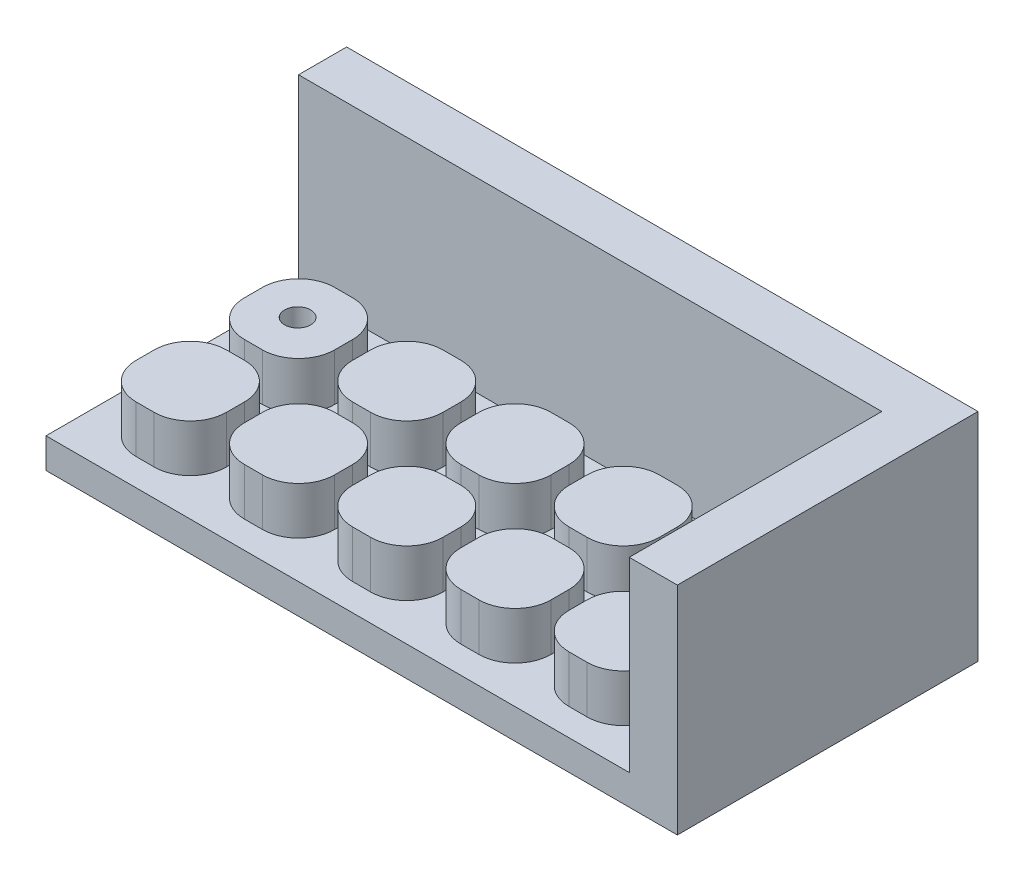
from build123d import *

# Parameters (mm, degrees)
SKETCH2_W            = 133.35
SKETCH2_H            = 63.5
BOSS_EXTRUDE2_DEPTH  = 6.35
BOSS_EXTRUDE3_DEPTH  = 45.72
BOSS_EXTRUDE1_DEPTH  = 10
LPATTERN1_COUNT      = 5
LPATTERN1_PITCH      = 22.86
LPATTERN1_COUNT_DIR2 = 2
LPATTERN1_PITCH_DIR2 = 22.86
SKETCH6_R            = 2.75
CUT_EXTRUDE1_DEPTH   = 5.5


with BuildPart() as part:
    # Sketch2 → Boss-Extrude2 (new body)
    with BuildSketch(Plane(origin=(0, 0, 0), x_dir=(1, 0, 0), z_dir=(0, 1, 0))):
        with Locations((66.675, 31.75)):
            Rectangle(SKETCH2_W, SKETCH2_H)
    extrude(amount=BOSS_EXTRUDE2_DEPTH)

    # Sketch2<4> → Boss-Extrude3 (add)
    with BuildSketch(Plane(origin=(0, 0, 0), x_dir=(1, 0, 0), z_dir=(0, 1, 0))):
        Polygon((123.19, 53.34), (123.19, 0), (133.35, 0), (133.35, 63.5), (0, 63.5), (0, 53.34), align=None)
    extrude(amount=BOSS_EXTRUDE3_DEPTH)

    # Sketch1 → Boss-Extrude1 (add)
    with BuildSketch(Plane(origin=(0, 6.35, 6.35), x_dir=(1, 0, 0), z_dir=(0, 1, 0))):
        with BuildLine():
            Line((13.335, 31.115), (17.145, 31.115))
            ThreePointArc((17.145, 31.115), (22.533153673, 28.883153673), (24.765, 23.495))
            Line((24.765, 23.495), (24.765, 19.685))
            ThreePointArc((24.765, 19.685), (22.533153673, 14.296846327), (17.145, 12.065))
            Line((17.145, 12.065), (13.335, 12.065))
            ThreePointArc((13.335, 12.065), (7.946846327, 14.296846327), (5.715, 19.685))
            Line((5.715, 19.685), (5.715, 23.495))
            ThreePointArc((5.715, 23.495), (7.946846327, 28.883153673), (13.335, 31.115))
        make_face()
    boss_extrude1 = extrude(amount=BOSS_EXTRUDE1_DEPTH)

    # LPattern1: Boss-Extrude1 5 × 2
    with Locations(*[(i * LPATTERN1_PITCH, 0, -j * LPATTERN1_PITCH_DIR2) for i in range(LPATTERN1_COUNT) for j in range(LPATTERN1_COUNT_DIR2) if (i, j) != (0, 0)]):
        add(boss_extrude1)

    # Sketch6 → Cut-Extrude1 (cut)
    with BuildSketch(Plane(origin=(0, 16.35, 0), x_dir=(1, 0, 0), z_dir=(0, 1, 0))):
        with Locations((106.354086264, 38.229532142)):
            Circle(SKETCH6_R)
        with Locations((14.914086264, 38.229532142)):
            Circle(SKETCH6_R)
    extrude(amount=-CUT_EXTRUDE1_DEPTH, mode=Mode.SUBTRACT)


solid = part.part
